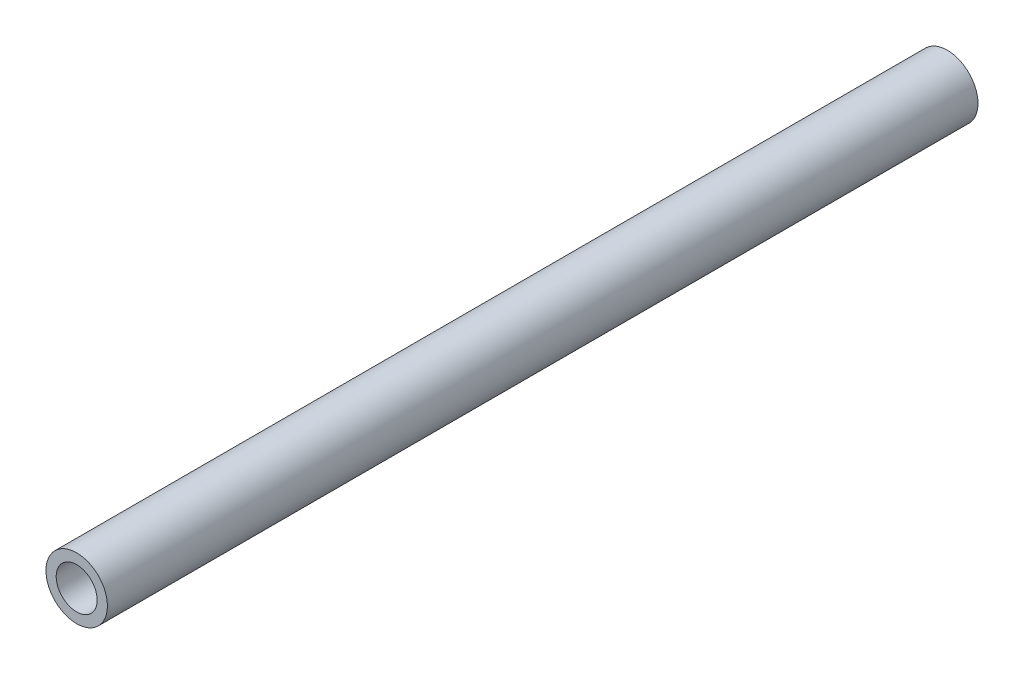
from build123d import *

# Parameters (mm, degrees)
SKETCH1_R           = 3
SKETCH1_R_2         = 2
BOSS_EXTRUDE1_DEPTH = 85


with BuildPart() as part:
    # Sketch1 → Boss-Extrude1 (new body)
    with BuildSketch(Plane.XY):
        Circle(SKETCH1_R)
        Circle(SKETCH1_R_2, mode=Mode.SUBTRACT)
    extrude(amount=BOSS_EXTRUDE1_DEPTH)


solid = part.part
